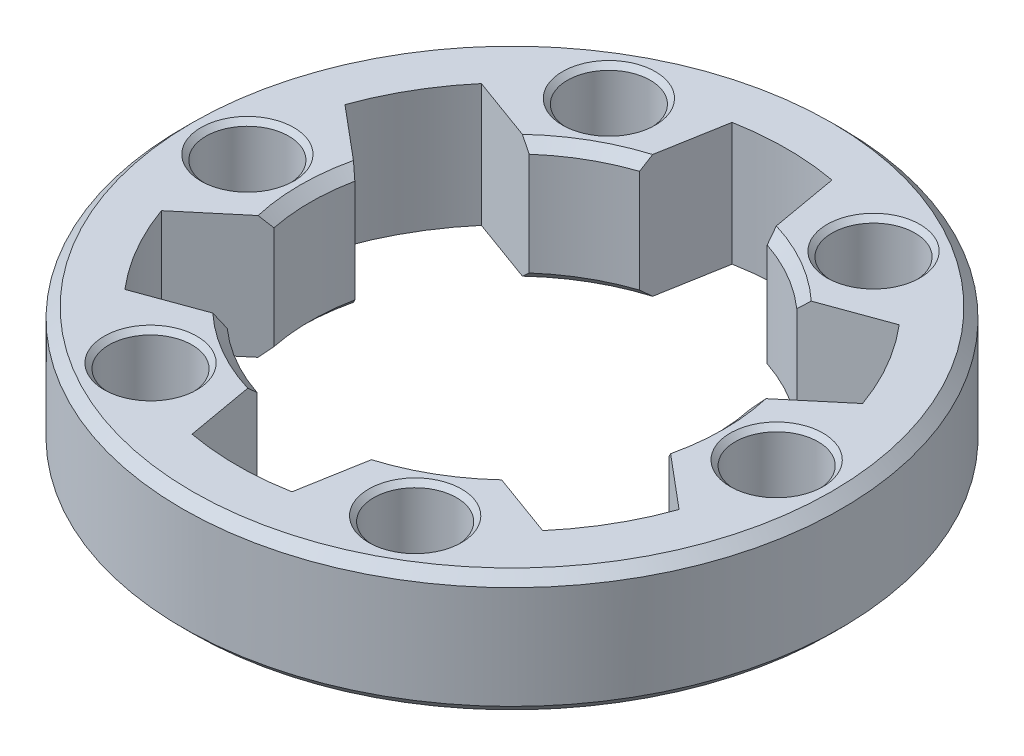
from build123d import *

# Parameters (mm, degrees)
ESBO_O1_W             = 12.8
ESBO_O1_H             = 12.3
CHANFRO1_SIZE         = 1
CORTE_EXTRUS_O1_DEPTH = 49.262718531
ESBO_O3_R             = 4.15
CORTE_EXTRUS_O2_DEPTH = 49.262718531
CHANFRO2_SIZE         = 0.5


with BuildPart() as part:
    # Esboço1 → Revolução1 (revolve)
    with BuildSketch(Plane.XY, mode=Mode.PRIVATE) as revolu_o1_sk:
        with Locations((26.6, 6.15)):
            Rectangle(ESBO_O1_W, ESBO_O1_H)
    revolve(revolu_o1_sk.sketch.rotate(Axis((0, -47.977777778, 0), (0, 1, 0)), 90), axis=Axis((0, -47.977777778, 0), (0, 1, 0)))

    # Chanfro1
    chanfro1_edges = [part.edges().sort_by_distance(p)[0] for p in [
        (0, 0, 33),
        (0, 0, 20.2),
        (0, 12.3, 20.2),
        (0, 12.3, 33),
    ]]
    chamfer(chanfro1_edges, length=CHANFRO1_SIZE)

    # Esboço2 → Corte-extrusão1 (cut, through all)
    with BuildSketch(Plane(origin=(0, 12.3, 0), x_dir=(1, 0, 0), z_dir=(0, 1, 0))):
        with BuildLine():
            Line((20.918742494, 17.850944302), (10.058223509, 13.898038663))
            Line((10.058223509, 13.898038663), (17.065166299, 1.761657744))
            Line((17.065166299, 1.761657744), (25.918742494, 9.190690264))
            ThreePointArc((25.918742494, 9.190690264), (23.815698604, 13.75), (20.918742494, 17.850944302))
        make_face()
        with BuildLine():
            Line((-5, 27.041634566), (-7.00694279, 15.659696407))
            Line((-7.00694279, 15.659696407), (7.00694279, 15.659696407))
            Line((7.00694279, 15.659696407), (5, 27.041634566))
            ThreePointArc((5, 27.041634566), (0, 27.5), (-5, 27.041634566))
        make_face()
        with BuildLine():
            Line((25.918742494, -9.190690264), (17.065166299, -1.761657744))
            Line((17.065166299, -1.761657744), (10.058223509, -13.898038663))
            Line((10.058223509, -13.898038663), (20.918742494, -17.850944302))
            ThreePointArc((20.918742494, -17.850944302), (23.815698604, -13.75), (25.918742494, -9.190690264))
        make_face()
        with BuildLine():
            Line((5, -27.041634566), (7.00694279, -15.659696407))
            Line((7.00694279, -15.659696407), (-7.00694279, -15.659696407))
            Line((-7.00694279, -15.659696407), (-5, -27.041634566))
            ThreePointArc((-5, -27.041634566), (0, -27.5), (5, -27.041634566))
        make_face()
        with BuildLine():
            Line((-20.918742494, -17.850944302), (-10.058223509, -13.898038663))
            Line((-10.058223509, -13.898038663), (-17.065166299, -1.761657744))
            Line((-17.065166299, -1.761657744), (-25.918742494, -9.190690264))
            ThreePointArc((-25.918742494, -9.190690264), (-23.815698604, -13.75), (-20.918742494, -17.850944302))
        make_face()
        with BuildLine():
            Line((-25.918742494, 9.190690264), (-17.065166299, 1.761657744))
            Line((-17.065166299, 1.761657744), (-10.058223509, 13.898038663))
            Line((-10.058223509, 13.898038663), (-20.918742494, 17.850944302))
            ThreePointArc((-20.918742494, 17.850944302), (-23.815698604, 13.75), (-25.918742494, 9.190690264))
        make_face()
    extrude(amount=-CORTE_EXTRUS_O1_DEPTH, mode=Mode.SUBTRACT)

    # Esboço3 → Corte-extrusão2 (cut, through all)
    with BuildSketch(Plane(origin=(0, 12.3, 0), x_dir=(1, 0, 0), z_dir=(0, 1, 0))):
        with Locations(Location((-26.5, 0, 0), (0, 0, 270))):
            Circle(ESBO_O3_R)
        with Locations(Location((-13.25, 22.9496732, 0), (0, 0, 270))):
            Circle(ESBO_O3_R)
        with Locations(Location((13.25, 22.9496732, 0), (0, 0, 270))):
            Circle(ESBO_O3_R)
        with Locations(Location((26.5, 0, 0), (0, 0, 270))):
            Circle(ESBO_O3_R)
        with Locations(Location((13.25, -22.9496732, 0), (0, 0, 270))):
            Circle(ESBO_O3_R)
        with Locations(Location((-13.25, -22.9496732, 0), (0, 0, 270))):
            Circle(ESBO_O3_R)
    extrude(amount=-CORTE_EXTRUS_O2_DEPTH, mode=Mode.SUBTRACT)

    # Chanfro2
    chanfro2_edges = [part.edges().sort_by_distance(p)[0] for p in [
        (-26.5, 0, -4.15),
        (-26.5, 12.3, -4.15),
        (-13.25, 0, -27.0996732),
        (-13.25, 12.3, -27.0996732),
        (13.25, 0, -27.0996732),
        (13.25, 12.3, -27.0996732),
        (26.5, 0, -4.15),
        (26.5, 12.3, -4.15),
        (13.25, 0, 18.7996732),
        (13.25, 12.3, 18.7996732),
        (-13.25, 0, 18.7996732),
        (-13.25, 12.3, 18.7996732),
    ]]
    chamfer(chanfro2_edges, length=CHANFRO2_SIZE)


solid = part.part
